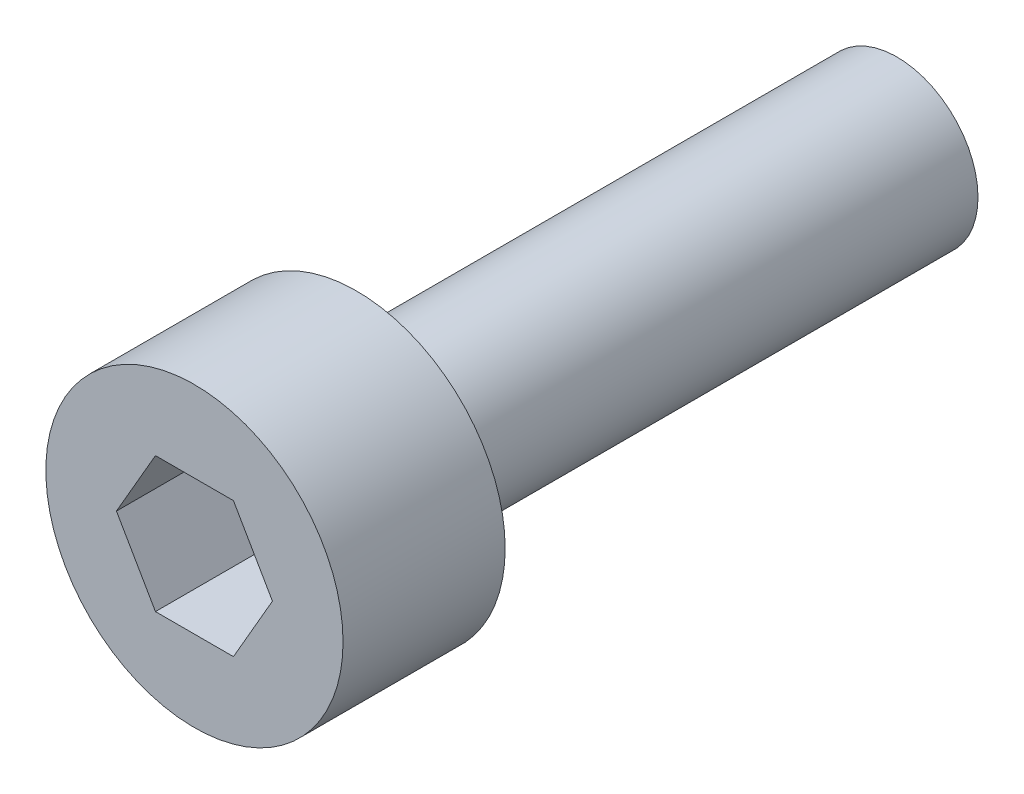
from build123d import *

# Parameters (mm, degrees)
ESQUISSE1_R             = 1.5
BOSS_EXTRU_1_DEPTH      = 10
ESQUISSE2_R             = 2.75
BOSS_EXTRU_2_DEPTH      = 3
ENL_V_MAT_EXTRU_1_DEPTH = 2


with BuildPart() as part:
    # Esquisse1 → Boss.-Extru.1 (new body)
    with BuildSketch(Plane.XY):
        Circle(ESQUISSE1_R)
    extrude(amount=BOSS_EXTRU_1_DEPTH)

    # Esquisse2 → Boss.-Extru.2 (add)
    with BuildSketch(Plane.XY.offset(10)):
        Circle(ESQUISSE2_R)
    extrude(amount=BOSS_EXTRU_2_DEPTH)

    # Esquisse3 → Enlèv. mat.-Extru.1 (cut)
    with BuildSketch(Plane.XY.offset(13)):
        Polygon((1.443375673, 0), (0.721687836, 1.25), (-0.721687836, 1.25), (-1.443375673, 0), (-0.721687836, -1.25), (0.721687836, -1.25), align=None)
    extrude(amount=-ENL_V_MAT_EXTRU_1_DEPTH, mode=Mode.SUBTRACT)


solid = part.part
